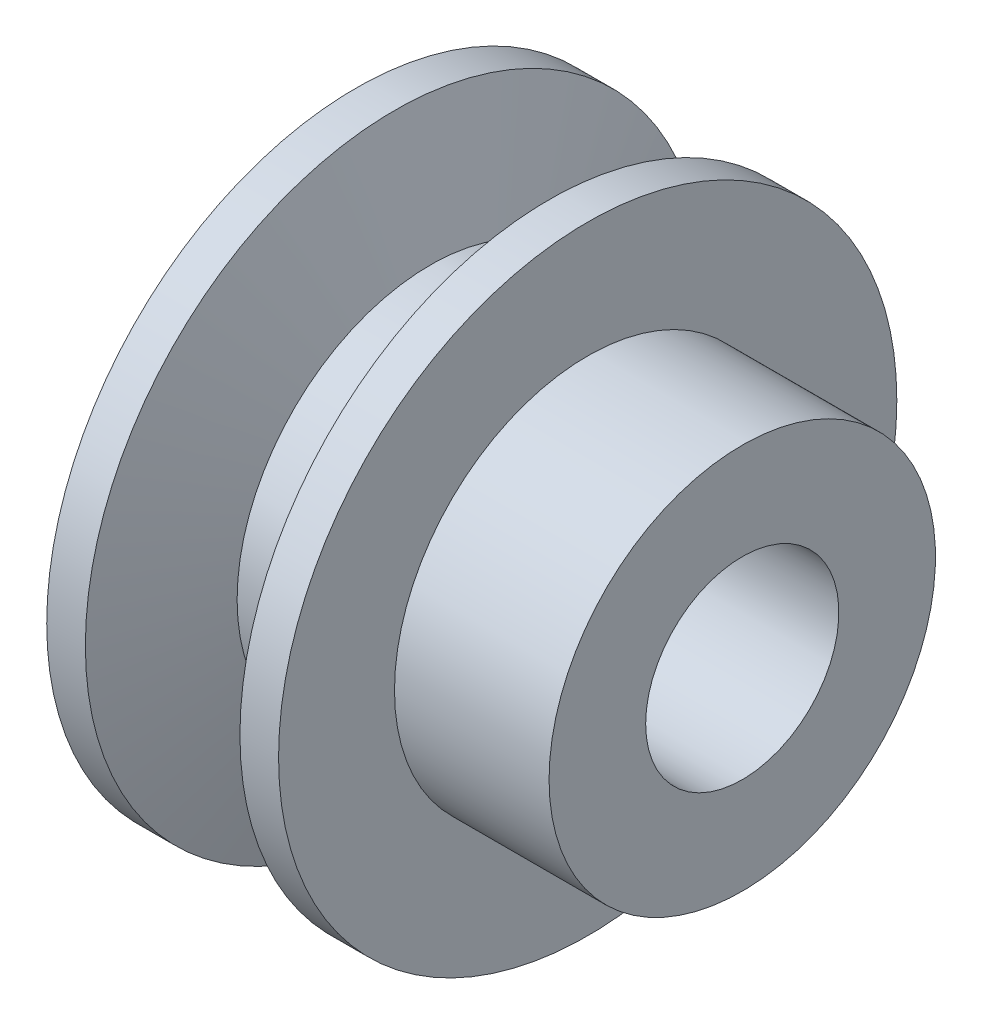
from build123d import *


with BuildPart() as part:
    # Sketch1 → Revolve1 (revolve)
    with BuildSketch(Plane.XY, mode=Mode.PRIVATE) as revolve1_sk:
        Polygon((635, 1016), (474.625871083, 635), (244.737675707, 635), (127, 1016), (0, 1016), (0, 508), (190.5, 317.5), (1270, 317.5), (1270, 635), (762, 635), (762, 1016), align=None)
    revolve(revolve1_sk.sketch.rotate(Axis((0, 0, 0), (1, 0, 0)), 90), axis=Axis((0, 0, 0), (1, 0, 0)))


solid = part.part
